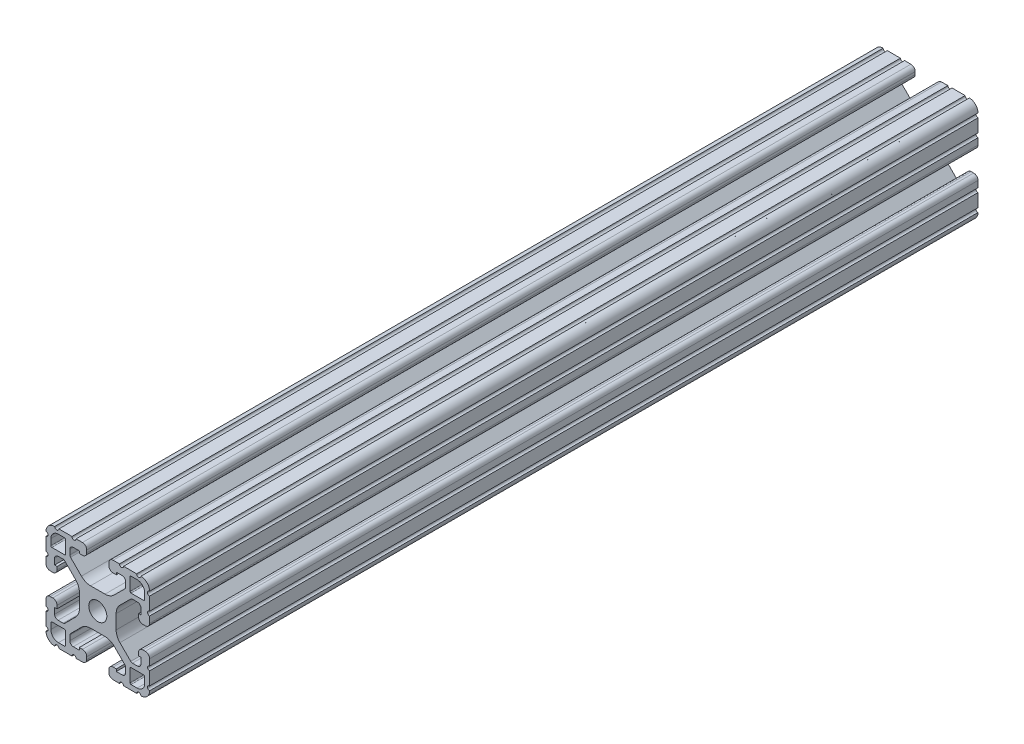
from build123d import *

# Parameters (mm, degrees)
SKETCH1_R           = 3.3274
BOSS_EXTRUDE1_DEPTH = 152.4


with BuildPart() as part:
    # Sketch1 → Boss-Extrude1 (new, symmetric)
    with BuildSketch(Plane.XY):
        with BuildLine():
            Line((-10.02670034, 12.151875049), (-6.021451835, 8.147301292))
            ThreePointArc((-6.021451835, 8.147301292), (-4.48060392, 7.11788044), (-2.663118988, 6.7564))
            Line((-2.663118988, 6.7564), (2.663118988, 6.7564))
            ThreePointArc((2.663118988, 6.7564), (4.48060392, 7.11788044), (6.021451835, 8.147301292))
            Line((6.021451835, 8.147301292), (10.02670034, 12.151875049))
            ThreePointArc((10.02670034, 12.151875049), (10.219349756, 12.440155844), (10.287, 12.78021916))
            Line((10.287, 12.78021916), (10.287, 14.55471092))
            ThreePointArc((10.287, 14.55471092), (9.915025612, 15.452736532), (9.017, 15.82471092))
            Line((9.017, 15.82471092), (6.814144259, 15.82471092))
            Line((6.814144259, 15.82471092), (6.814144259, 14.986))
            Line((6.814144259, 14.986), (5.6388, 14.986))
            ThreePointArc((5.6388, 14.986), (4.525248241, 15.447248241), (4.064, 16.5608))
            Line((4.064, 16.5608), (4.064, 17.4752))
            ThreePointArc((4.064, 17.4752), (4.525248241, 18.588751759), (5.6388, 19.05))
            Line((5.6388, 19.05), (7.9756, 19.05))
            ThreePointArc((7.9756, 19.05), (8.7376, 18.288), (9.4996, 19.05))
            Line((9.4996, 19.05), (14.3256, 19.05))
            ThreePointArc((14.3256, 19.05), (15.0876, 18.288), (15.8496, 19.05))
            Line((15.8496, 19.05), (15.875, 19.05))
            ThreePointArc((15.875, 19.05), (18.12006403, 18.12006403), (19.05, 15.875))
            Line((19.05, 15.875), (19.05, 15.8496))
            ThreePointArc((19.05, 15.8496), (18.288, 15.0876), (19.05, 14.3256))
            Line((19.05, 14.3256), (19.05, 9.4996))
            ThreePointArc((19.05, 9.4996), (18.288, 8.7376), (19.05, 7.9756))
            Line((19.05, 7.9756), (19.05, 5.6388))
            ThreePointArc((19.05, 5.6388), (18.588751759, 4.525248241), (17.4752, 4.064))
            Line((17.4752, 4.064), (16.5608, 4.064))
            ThreePointArc((16.5608, 4.064), (15.447248241, 4.525248241), (14.986, 5.6388))
            Line((14.986, 5.6388), (14.986, 6.750644259))
            Line((14.986, 6.750644259), (15.879033733, 6.750644259))
            Line((15.879033733, 6.750644259), (15.879033733, 8.919211783))
            ThreePointArc((15.879033733, 8.919211783), (15.507059345, 9.817237395), (14.609033733, 10.189211783))
            Line((14.609033733, 10.189211783), (12.742784468, 10.189211783))
            ThreePointArc((12.742784468, 10.189211783), (12.402613491, 10.121555016), (12.114219497, 9.928882664))
            Line((12.114219497, 9.928882664), (8.147867153, 5.963198517))
            ThreePointArc((8.147867153, 5.963198517), (7.118033561, 4.422154408), (6.7564, 2.604299809))
            Line((6.7564, 2.604299809), (6.7564, -2.604299809))
            ThreePointArc((6.7564, -2.604299809), (7.118033561, -4.422154408), (8.147867153, -5.963198517))
            Line((8.147867153, -5.963198517), (12.114219497, -9.928882664))
            ThreePointArc((12.114219497, -9.928882664), (12.402613491, -10.121555016), (12.742784468, -10.189211783))
            Line((12.742784468, -10.189211783), (14.609033733, -10.189211783))
            ThreePointArc((14.609033733, -10.189211783), (15.507059345, -9.817237395), (15.879033733, -8.919211783))
            Line((15.879033733, -8.919211783), (15.879033733, -6.750644259))
            Line((15.879033733, -6.750644259), (14.986, -6.750644259))
            Line((14.986, -6.750644259), (14.986, -5.6388))
            ThreePointArc((14.986, -5.6388), (15.447248241, -4.525248241), (16.5608, -4.064))
            Line((16.5608, -4.064), (17.4752, -4.064))
            ThreePointArc((17.4752, -4.064), (18.588751759, -4.525248241), (19.05, -5.6388))
            Line((19.05, -5.6388), (19.05, -7.9756))
            ThreePointArc((19.05, -7.9756), (18.288, -8.7376), (19.05, -9.4996))
            Line((19.05, -9.4996), (19.05, -14.3256))
            ThreePointArc((19.05, -14.3256), (18.288, -15.0876), (19.05, -15.8496))
            Line((19.05, -15.8496), (19.05, -15.875))
            ThreePointArc((19.05, -15.875), (18.12006403, -18.12006403), (15.875, -19.05))
            Line((15.875, -19.05), (15.8496, -19.05))
            ThreePointArc((15.8496, -19.05), (15.0876, -18.288), (14.3256, -19.05))
            Line((14.3256, -19.05), (9.4996, -19.05))
            ThreePointArc((9.4996, -19.05), (8.7376, -18.288), (7.9756, -19.05))
            Line((7.9756, -19.05), (5.6388, -19.05))
            ThreePointArc((5.6388, -19.05), (4.525248241, -18.588751759), (4.064, -17.4752))
            Line((4.064, -17.4752), (4.064, -16.5608))
            ThreePointArc((4.064, -16.5608), (4.525248241, -15.447248241), (5.6388, -14.986))
            Line((5.6388, -14.986), (6.814144259, -14.986))
            Line((6.814144259, -14.986), (6.814144259, -15.82471092))
            Line((6.814144259, -15.82471092), (9.017, -15.82471092))
            ThreePointArc((9.017, -15.82471092), (9.915025612, -15.452736532), (10.287, -14.55471092))
            Line((10.287, -14.55471092), (10.287, -12.78021916))
            ThreePointArc((10.287, -12.78021916), (10.219349756, -12.440155844), (10.02670034, -12.151875049))
            Line((10.02670034, -12.151875049), (6.021451835, -8.147301292))
            ThreePointArc((6.021451835, -8.147301292), (4.48060392, -7.11788044), (2.663118988, -6.7564))
            Line((2.663118988, -6.7564), (-2.663118988, -6.7564))
            ThreePointArc((-2.663118988, -6.7564), (-4.48060392, -7.11788044), (-6.021451835, -8.147301292))
            Line((-6.021451835, -8.147301292), (-10.02670034, -12.151875049))
            ThreePointArc((-10.02670034, -12.151875049), (-10.219349756, -12.440155844), (-10.287, -12.78021916))
            Line((-10.287, -12.78021916), (-10.287, -14.55471092))
            ThreePointArc((-10.287, -14.55471092), (-9.915025612, -15.452736532), (-9.017, -15.82471092))
            Line((-9.017, -15.82471092), (-6.814144259, -15.82471092))
            Line((-6.814144259, -15.82471092), (-6.814144259, -14.986))
            Line((-6.814144259, -14.986), (-5.6388, -14.986))
            ThreePointArc((-5.6388, -14.986), (-4.525248241, -15.447248241), (-4.064, -16.5608))
            Line((-4.064, -16.5608), (-4.064, -17.4752))
            ThreePointArc((-4.064, -17.4752), (-4.525248241, -18.588751759), (-5.6388, -19.05))
            Line((-5.6388, -19.05), (-7.9756, -19.05))
            ThreePointArc((-7.9756, -19.05), (-8.7376, -18.288), (-9.4996, -19.05))
            Line((-9.4996, -19.05), (-14.3256, -19.05))
            ThreePointArc((-14.3256, -19.05), (-15.0876, -18.288), (-15.8496, -19.05))
            Line((-15.8496, -19.05), (-15.875, -19.05))
            ThreePointArc((-15.875, -19.05), (-18.12006403, -18.12006403), (-19.05, -15.875))
            Line((-19.05, -15.875), (-19.05, -15.8496))
            ThreePointArc((-19.05, -15.8496), (-18.288, -15.0876), (-19.05, -14.3256))
            Line((-19.05, -14.3256), (-19.05, -9.4996))
            ThreePointArc((-19.05, -9.4996), (-18.288, -8.7376), (-19.05, -7.9756))
            Line((-19.05, -7.9756), (-19.05, -5.6388))
            ThreePointArc((-19.05, -5.6388), (-18.588751759, -4.525248241), (-17.4752, -4.064))
            Line((-17.4752, -4.064), (-16.5608, -4.064))
            ThreePointArc((-16.5608, -4.064), (-15.447248241, -4.525248241), (-14.986, -5.6388))
            Line((-14.986, -5.6388), (-14.986, -6.750644259))
            Line((-14.986, -6.750644259), (-15.879033733, -6.750644259))
            Line((-15.879033733, -6.750644259), (-15.879033733, -8.919211783))
            ThreePointArc((-15.879033733, -8.919211783), (-15.507059345, -9.817237395), (-14.609033733, -10.189211783))
            Line((-14.609033733, -10.189211783), (-12.742784468, -10.189211783))
            ThreePointArc((-12.742784468, -10.189211783), (-12.402613491, -10.121555016), (-12.114219497, -9.928882664))
            Line((-12.114219497, -9.928882664), (-8.147867153, -5.963198517))
            ThreePointArc((-8.147867153, -5.963198517), (-7.118033561, -4.422154408), (-6.7564, -2.604299809))
            Line((-6.7564, -2.604299809), (-6.7564, 2.604299809))
            ThreePointArc((-6.7564, 2.604299809), (-7.118033561, 4.422154408), (-8.147867153, 5.963198517))
            Line((-8.147867153, 5.963198517), (-12.114219497, 9.928882664))
            ThreePointArc((-12.114219497, 9.928882664), (-12.402613491, 10.121555016), (-12.742784468, 10.189211783))
            Line((-12.742784468, 10.189211783), (-14.609033733, 10.189211783))
            ThreePointArc((-14.609033733, 10.189211783), (-15.507059345, 9.817237395), (-15.879033733, 8.919211783))
            Line((-15.879033733, 8.919211783), (-15.879033733, 6.750644259))
            Line((-15.879033733, 6.750644259), (-14.986, 6.750644259))
            Line((-14.986, 6.750644259), (-14.986, 5.6388))
            ThreePointArc((-14.986, 5.6388), (-15.447248241, 4.525248241), (-16.5608, 4.064))
            Line((-16.5608, 4.064), (-17.4752, 4.064))
            ThreePointArc((-17.4752, 4.064), (-18.588751759, 4.525248241), (-19.05, 5.6388))
            Line((-19.05, 5.6388), (-19.05, 7.9756))
            ThreePointArc((-19.05, 7.9756), (-18.288, 8.7376), (-19.05, 9.4996))
            Line((-19.05, 9.4996), (-19.05, 14.3256))
            ThreePointArc((-19.05, 14.3256), (-18.288, 15.0876), (-19.05, 15.8496))
            Line((-19.05, 15.8496), (-19.05, 15.875))
            ThreePointArc((-19.05, 15.875), (-18.12006403, 18.12006403), (-15.875, 19.05))
            Line((-15.875, 19.05), (-15.8496, 19.05))
            ThreePointArc((-15.8496, 19.05), (-15.0876, 18.288), (-14.3256, 19.05))
            Line((-14.3256, 19.05), (-9.4996, 19.05))
            ThreePointArc((-9.4996, 19.05), (-8.7376, 18.288), (-7.9756, 19.05))
            Line((-7.9756, 19.05), (-5.6388, 19.05))
            ThreePointArc((-5.6388, 19.05), (-4.525248241, 18.588751759), (-4.064, 17.4752))
            Line((-4.064, 17.4752), (-4.064, 16.5608))
            ThreePointArc((-4.064, 16.5608), (-4.525248241, 15.447248241), (-5.6388, 14.986))
            Line((-5.6388, 14.986), (-6.814144259, 14.986))
            Line((-6.814144259, 14.986), (-6.814144259, 15.82471092))
            Line((-6.814144259, 15.82471092), (-9.017, 15.82471092))
            ThreePointArc((-9.017, 15.82471092), (-9.915025612, 15.452736532), (-10.287, 14.55471092))
            Line((-10.287, 14.55471092), (-10.287, 12.78021916))
            ThreePointArc((-10.287, 12.78021916), (-10.219349756, 12.440155844), (-10.02670034, 12.151875049))
        make_face()
        with Locations(Location((0, 0, 0), (0, 0, 180))):
            Circle(SKETCH1_R, mode=Mode.SUBTRACT)
        with BuildLine():
            Line((-16.891, 11.8618), (-12.2428, 11.8618))
            ThreePointArc((-12.2428, 11.8618), (-11.973392316, 11.973392316), (-11.8618, 12.2428))
            Line((-11.8618, 12.2428), (-11.8618, 16.891))
            ThreePointArc((-11.8618, 16.891), (-11.973392316, 17.160407684), (-12.2428, 17.272))
            Line((-12.2428, 17.272), (-14.478, 17.272))
            ThreePointArc((-14.478, 17.272), (-16.453656347, 16.453656347), (-17.272, 14.478))
            Line((-17.272, 14.478), (-17.272, 12.2428))
            ThreePointArc((-17.272, 12.2428), (-17.160407684, 11.973392316), (-16.891, 11.8618))
        make_face(mode=Mode.SUBTRACT)
        with BuildLine():
            Line((-17.272, -14.478), (-17.272, -12.2428))
            ThreePointArc((-17.272, -12.2428), (-17.160407684, -11.973392316), (-16.891, -11.8618))
            Line((-16.891, -11.8618), (-12.2428, -11.8618))
            ThreePointArc((-12.2428, -11.8618), (-11.973392316, -11.973392316), (-11.8618, -12.2428))
            Line((-11.8618, -12.2428), (-11.8618, -16.891))
            ThreePointArc((-11.8618, -16.891), (-11.973392316, -17.160407684), (-12.2428, -17.272))
            Line((-12.2428, -17.272), (-14.478, -17.272))
            ThreePointArc((-14.478, -17.272), (-16.453656347, -16.453656347), (-17.272, -14.478))
        make_face(mode=Mode.SUBTRACT)
        with BuildLine():
            Line((17.272, 14.478), (17.272, 12.2428))
            ThreePointArc((17.272, 12.2428), (17.160407684, 11.973392316), (16.891, 11.8618))
            Line((16.891, 11.8618), (12.2428, 11.8618))
            ThreePointArc((12.2428, 11.8618), (11.973392316, 11.973392316), (11.8618, 12.2428))
            Line((11.8618, 12.2428), (11.8618, 16.891))
            ThreePointArc((11.8618, 16.891), (11.973392316, 17.160407684), (12.2428, 17.272))
            Line((12.2428, 17.272), (14.478, 17.272))
            ThreePointArc((14.478, 17.272), (16.453656347, 16.453656347), (17.272, 14.478))
        make_face(mode=Mode.SUBTRACT)
        with BuildLine():
            Line((16.891, -11.8618), (12.2428, -11.8618))
            ThreePointArc((12.2428, -11.8618), (11.973392316, -11.973392316), (11.8618, -12.2428))
            Line((11.8618, -12.2428), (11.8618, -16.891))
            ThreePointArc((11.8618, -16.891), (11.973392316, -17.160407684), (12.2428, -17.272))
            Line((12.2428, -17.272), (14.478, -17.272))
            ThreePointArc((14.478, -17.272), (16.453656347, -16.453656347), (17.272, -14.478))
            Line((17.272, -14.478), (17.272, -12.2428))
            ThreePointArc((17.272, -12.2428), (17.160407684, -11.973392316), (16.891, -11.8618))
        make_face(mode=Mode.SUBTRACT)
    extrude(amount=BOSS_EXTRUDE1_DEPTH, both=True)


solid = part.part
